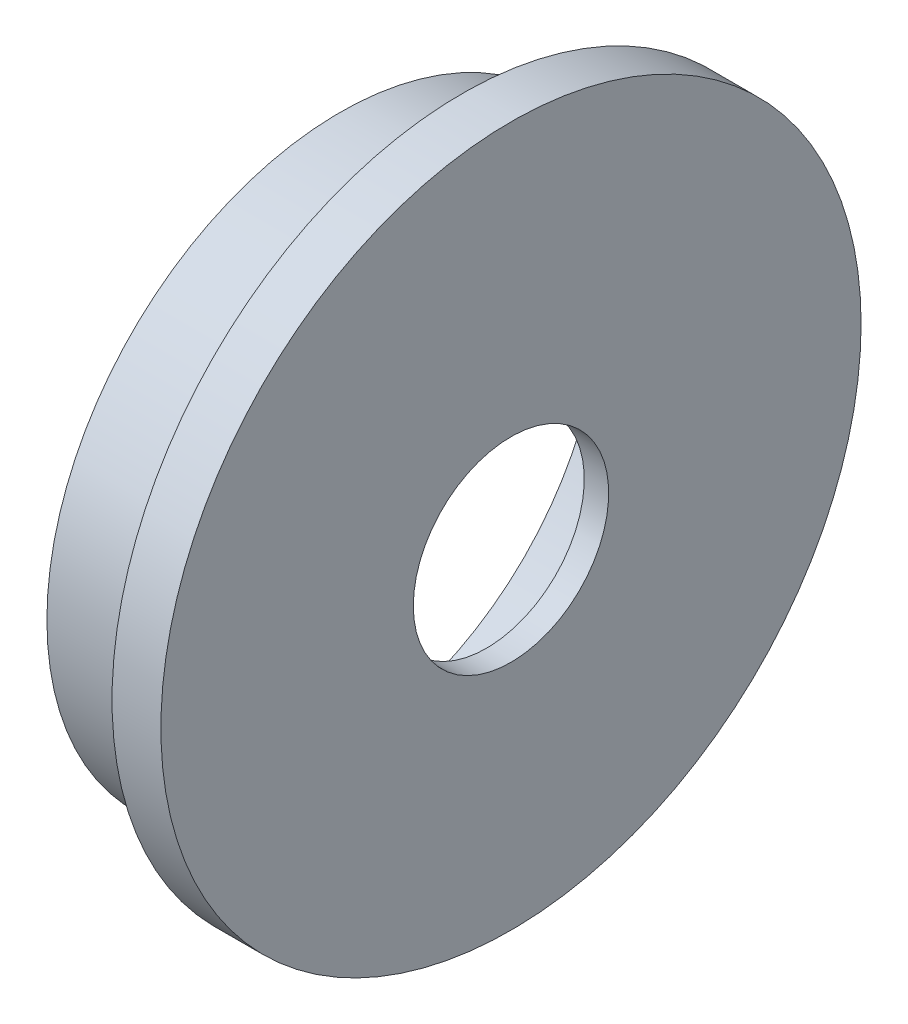
from build123d import *

# Parameters (mm, degrees)
ESQUISSE2_R        = 43
ESQUISSE2_R_2      = 17.284931715
BOSS_EXTRU_1_DEPTH = 6


with BuildPart() as part:
    # Esquisse1 → Base-Révolution (revolve)
    with BuildSketch(Plane.XY):
        Polygon((0, 12), (0, 34), (-10, 34), (-10, 36), (-21, 36), (-21, 32), (-12, 32), (-12, 28), (-4, 28), (-4, 25), (-10, 25), (-10, 22), (-4, 22), (-4, 18), (-3, 18), (-3, 12), align=None)
    revolve(axis=Axis((-25.921870853, 0, 0), (1, 0, 0)))

    # Esquisse2 → Boss.-Extru.1 (add)
    with BuildSketch(Plane(origin=(0, 0, 0), x_dir=(0, 0, -1), z_dir=(1, 0, 0))):
        with Locations((0, 2.5)):
            Circle(ESQUISSE2_R)
        Circle(ESQUISSE2_R_2, mode=Mode.SUBTRACT)
    extrude(amount=-BOSS_EXTRU_1_DEPTH)


solid = part.part
